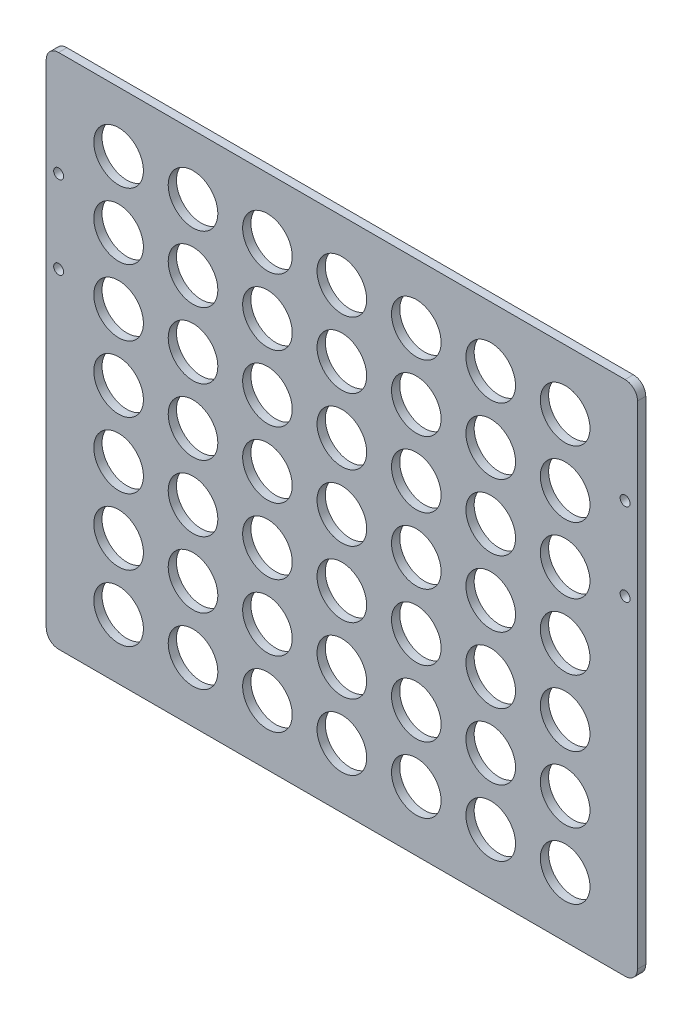
from build123d import *

# Parameters (mm, degrees)
SKETCH_1_W          = 143
SKETCH_1_H          = 125
EXTRUDE_1_DEPTH     = 2
FILLET_1_R          = 3
SKETCH_2_R          = 6
CUT_EXTRUDE_1_DEPTH = 10
SKETCH_3_R          = 1.2
CUT_EXTRUDE_2_DEPTH = 10


with BuildPart() as part:
    # 草图1 → 凸台-拉伸1 (new body)
    with BuildSketch(Plane.XY):
        Rectangle(SKETCH_1_W, SKETCH_1_H)
    extrude(amount=EXTRUDE_1_DEPTH)

    # 圆角1
    fillet_1_edges = [part.edges().sort_by_distance(p)[0] for p in [
        (-71.5, 62.5, 1),
        (71.5, 62.5, 1),
        (71.5, -62.5, 1),
        (-71.5, -62.5, 1),
    ]]
    fillet(fillet_1_edges, radius=FILLET_1_R)

    # 草图2 → 切除-拉伸1 (cut)
    with BuildSketch(Plane(origin=(0, 0, 0), x_dir=(-1, 0, 0), z_dir=(0, 0, -1))):
        Circle(SKETCH_2_R)
        with Locations((18, 0)):
            Circle(SKETCH_2_R)
        with Locations((36, 0)):
            Circle(SKETCH_2_R)
        with Locations((54, 0)):
            Circle(SKETCH_2_R)
        with Locations(Location((-54, 0, 0), (0, 0, 180))):
            Circle(SKETCH_2_R)
        with Locations(Location((-36, 0, 0), (0, 0, 180))):
            Circle(SKETCH_2_R)
        with Locations(Location((-18, 0, 0), (0, 0, 180))):
            Circle(SKETCH_2_R)
        with Locations((0, 16)):
            Circle(SKETCH_2_R)
        with Locations((18, 16)):
            Circle(SKETCH_2_R)
        with Locations((36, 16)):
            Circle(SKETCH_2_R)
        with Locations((54, 16)):
            Circle(SKETCH_2_R)
        with Locations(Location((-54, 16, 0), (0, 0, 180))):
            Circle(SKETCH_2_R)
        with Locations(Location((-36, 16, 0), (0, 0, 180))):
            Circle(SKETCH_2_R)
        with Locations(Location((-18, 16, 0), (0, 0, 180))):
            Circle(SKETCH_2_R)
        with Locations((0, 32)):
            Circle(SKETCH_2_R)
        with Locations((18, 32)):
            Circle(SKETCH_2_R)
        with Locations((36, 32)):
            Circle(SKETCH_2_R)
        with Locations((54, 32)):
            Circle(SKETCH_2_R)
        with Locations(Location((-54, 32, 0), (0, 0, 180))):
            Circle(SKETCH_2_R)
        with Locations(Location((-36, 32, 0), (0, 0, 180))):
            Circle(SKETCH_2_R)
        with Locations(Location((-18, 32, 0), (0, 0, 180))):
            Circle(SKETCH_2_R)
        with Locations((0, 48)):
            Circle(SKETCH_2_R)
        with Locations((18, 48)):
            Circle(SKETCH_2_R)
        with Locations((36, 48)):
            Circle(SKETCH_2_R)
        with Locations((54, 48)):
            Circle(SKETCH_2_R)
        with Locations(Location((-54, 48, 0), (0, 0, 180))):
            Circle(SKETCH_2_R)
        with Locations(Location((-36, 48, 0), (0, 0, 180))):
            Circle(SKETCH_2_R)
        with Locations(Location((-18, 48, 0), (0, 0, 180))):
            Circle(SKETCH_2_R)
        with Locations((0, -16)):
            Circle(SKETCH_2_R)
        with Locations((18, -16)):
            Circle(SKETCH_2_R)
        with Locations((36, -16)):
            Circle(SKETCH_2_R)
        with Locations((54, -16)):
            Circle(SKETCH_2_R)
        with Locations(Location((-54, -16, 0), (0, 0, 180))):
            Circle(SKETCH_2_R)
        with Locations(Location((-36, -16, 0), (0, 0, 180))):
            Circle(SKETCH_2_R)
        with Locations(Location((-18, -16, 0), (0, 0, 180))):
            Circle(SKETCH_2_R)
        with Locations((0, -32)):
            Circle(SKETCH_2_R)
        with Locations((18, -32)):
            Circle(SKETCH_2_R)
        with Locations((36, -32)):
            Circle(SKETCH_2_R)
        with Locations((54, -32)):
            Circle(SKETCH_2_R)
        with Locations(Location((-54, -32, 0), (0, 0, 180))):
            Circle(SKETCH_2_R)
        with Locations(Location((-36, -32, 0), (0, 0, 180))):
            Circle(SKETCH_2_R)
        with Locations(Location((-18, -32, 0), (0, 0, 180))):
            Circle(SKETCH_2_R)
        with Locations((0, -48)):
            Circle(SKETCH_2_R)
        with Locations((18, -48)):
            Circle(SKETCH_2_R)
        with Locations((36, -48)):
            Circle(SKETCH_2_R)
        with Locations((54, -48)):
            Circle(SKETCH_2_R)
        with Locations(Location((-54, -48, 0), (0, 0, 180))):
            Circle(SKETCH_2_R)
        with Locations(Location((-36, -48, 0), (0, 0, 180))):
            Circle(SKETCH_2_R)
        with Locations(Location((-18, -48, 0), (0, 0, 180))):
            Circle(SKETCH_2_R)
    extrude(amount=-CUT_EXTRUDE_1_DEPTH, mode=Mode.SUBTRACT)

    # 草图3 → 切除-拉伸2 (cut)
    with BuildSketch(Plane.XY.offset(2)):
        with Locations((-68.5, 37.12550176)):
            Circle(SKETCH_3_R)
        with Locations((-68.5, 17.12550176)):
            Circle(SKETCH_3_R)
        with Locations((68.5, 17.12550176)):
            Circle(SKETCH_3_R)
        with Locations((68.5, 37.12550176)):
            Circle(SKETCH_3_R)
    extrude(amount=-CUT_EXTRUDE_2_DEPTH, mode=Mode.SUBTRACT)


solid = part.part
